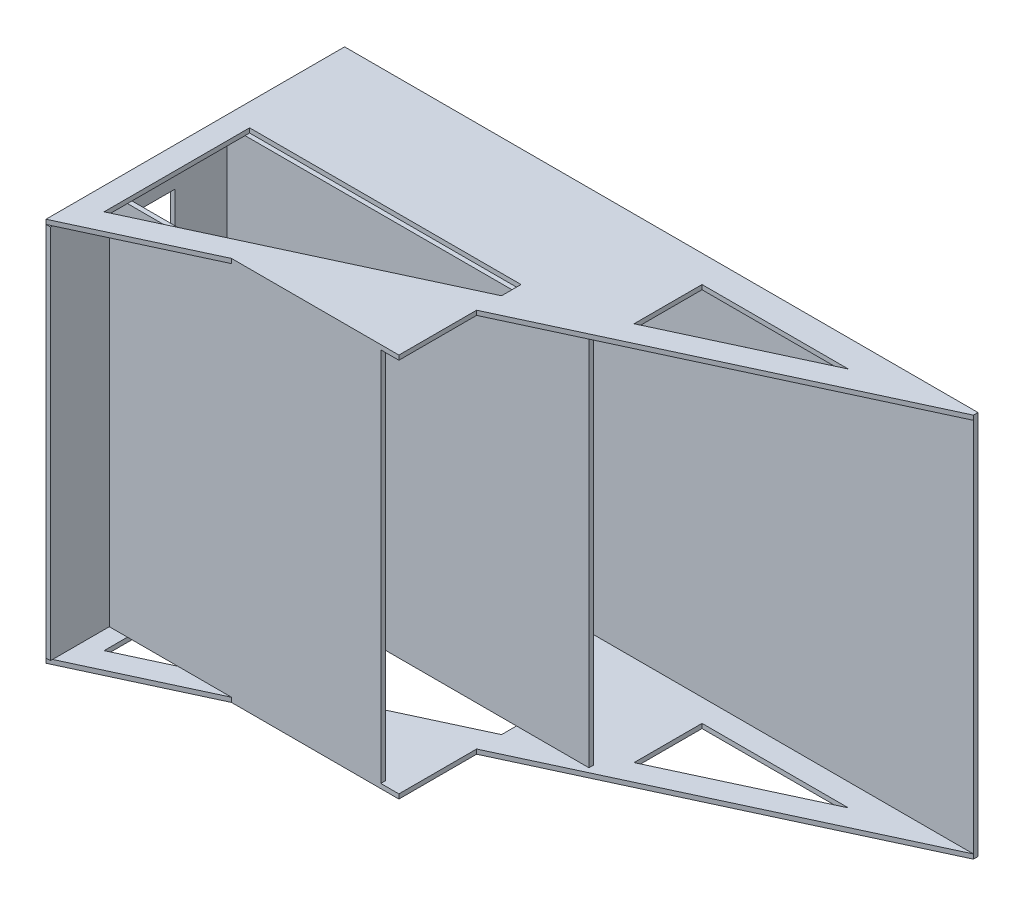
from build123d import *

# Parameters (mm, degrees)
SKETCH1_W             = 215.9
SKETCH1_H             = 355.6
BOSS_EXTRUDE1_DEPTH   = 2.54
BOSS_EXTRUDE2_DEPTH   = 2.54
CUT_EXTRUDE4_DEPTH    = 2.54
BOSS_EXTRUDE3_DEPTH   = 2.54
CUT_EXTRUDE5_DEPTH    = 2.54
SKETCH7_W             = 210.82
SKETCH7_H             = 165.1
SKETCH7_W_2           = 177.8
SKETCH7_H_2           = 31.75
BOSS_EXTRUDE4_DEPTH   = 2.54
SKETCH8_W             = 210.82
SKETCH8_H             = 2.54
BOSS_EXTRUDE6_DEPTH   = 203.2
SKETCH9_W             = 210.82
SKETCH9_H             = 2.54
BOSS_EXTRUDE7_DEPTH   = 152.4
BOSS_EXTRUDE8_START   = -2.54
BOSS_EXTRUDE8_DEPTH   = 2.54
BOSS_EXTRUDE9_START   = -2.54
BOSS_EXTRUDE9_DEPTH   = 2.54
BODY_MOVE_COPY2_ANGLE = 120


with BuildPart() as part:
    # Sketch1 → Boss-Extrude1 (new body)
    with BuildSketch(Plane(origin=(0, 0, 0), x_dir=(1, 0, 0), z_dir=(0, 1, 0))):
        with Locations((107.95, 177.8)):
            Rectangle(SKETCH1_W, SKETCH1_H)
    extrude(amount=BOSS_EXTRUDE1_DEPTH)

    # Sketch2 → Boss-Extrude2 (add)
    with BuildSketch(Plane(origin=(215.9, 0, 0), x_dir=(0, 0, -1), z_dir=(1, 0, 0))):
        Polygon((355.6, 2.54), (355.6, 167.64), (0, 2.54), align=None)
    extrude(amount=-BOSS_EXTRUDE2_DEPTH)

    # Sketch3 → Cut-Extrude4 (cut)
    with BuildSketch(Plane(origin=(215.9, 0, 0), x_dir=(0, 0, -1), z_dir=(1, 0, 0))):
        Polygon((139.7, 15.24), (57.51214351, 15.24), (139.7, 53.398647656), align=None)
        Polygon((190.5, 66.04), (190.5, 76.984361942), (342.9, 147.741504799), (342.9, 66.04), align=None)
    extrude(amount=-CUT_EXTRUDE4_DEPTH, mode=Mode.SUBTRACT)

    # Sketch5 → Boss-Extrude3 (add)
    with BuildSketch(Plane.ZY):
        Polygon((0, 2.54), (-355.6, 167.64), (-355.6, 2.54), align=None)
    extrude(amount=-BOSS_EXTRUDE3_DEPTH)

    # Sketch6 → Cut-Extrude5 (cut)
    with BuildSketch(Plane.ZY):
        Polygon((-139.7, 15.24), (-57.51214351, 15.24), (-139.7, 53.398647656), align=None)
        Polygon((-342.9, 66.04), (-190.5, 66.04), (-190.5, 76.984361942), (-342.9, 147.741504799), align=None)
    extrude(amount=-CUT_EXTRUDE5_DEPTH, mode=Mode.SUBTRACT)

    # Sketch7 → Boss-Extrude4 (add)
    with BuildSketch(Plane(origin=(0, 0, -355.6), x_dir=(-1, 0, 0), z_dir=(0, 0, -1))):
        with Locations((-107.95, 85.09)):
            Rectangle(SKETCH7_W, SKETCH7_H)
        with Locations((-107.95, 31.115)):
            Rectangle(SKETCH7_W_2, SKETCH7_H_2, mode=Mode.SUBTRACT)
        with Locations((-107.95, 113.665)):
            Rectangle(SKETCH7_W_2, SKETCH7_H_2, mode=Mode.SUBTRACT)
    extrude(amount=-BOSS_EXTRUDE4_DEPTH)

    # Sketch9 → Boss-Extrude7 (add)
    with BuildSketch(Plane.XY.offset(-353.06)):
        with Locations((107.95, 133.35)):
            Rectangle(SKETCH9_W, SKETCH9_H)
    extrude(amount=BOSS_EXTRUDE7_DEPTH)

    # Sketch10 → Boss-Extrude8 (add)
    with BuildSketch(Plane(origin=(215.9, 0, 0), x_dir=(0, 0, -1), z_dir=(1, 0, 0)).offset(BOSS_EXTRUDE8_START)):
        Polygon((284.48, 134.62), (190.5, 134.62), (190.5, 90.986428571), align=None)
    extrude(amount=BOSS_EXTRUDE8_DEPTH)

    # Sketch11 → Boss-Extrude9 (add)
    with BuildSketch(Plane.ZY.offset(BOSS_EXTRUDE9_START)):
        Polygon((-190.5, 134.62), (-284.48, 134.62), (-190.5, 90.986428571), align=None)
    extrude(amount=BOSS_EXTRUDE9_DEPTH)


with BuildPart() as body_2:
    # Sketch8 → Boss-Extrude6 (new body)
    with BuildSketch(Plane.XY.offset(-353.06)):
        with Locations((107.95, 67.31)):
            Rectangle(SKETCH8_W, SKETCH8_H)
    extrude(amount=BOSS_EXTRUDE6_DEPTH)


with BuildPart() as part_1:
    # Body-Move/Copy1: moved
    add(part.part.moved(Location((-107.95, 0, 0))))


with BuildPart() as body_2_1:
    # Body-Move/Copy1: moved
    add(body_2.part.moved(Location((-107.95, 0, 0))))


with BuildPart() as body_2_2:
    # Body-Move/Copy2: moved
    add(body_2_1.part.moved(Location((0, 0, 0))).rotate(Axis((46.355, 121.92, -168.275), (0.5773502691896252, 0.5773502691896252, 0.5773502691896272)), BODY_MOVE_COPY2_ANGLE))


with BuildPart() as part_2:
    # Body-Move/Copy2: moved
    add(part_1.part.moved(Location((0, 0, 0))).rotate(Axis((46.355, 121.92, -168.275), (0.5773502691896252, 0.5773502691896252, 0.5773502691896272)), BODY_MOVE_COPY2_ANGLE))


with BuildPart() as part_3:
    # Body-Move/Copy3: moved
    add(part_2.part.moved(Location((0, -75.692, 0))))


with BuildPart() as body_2_3:
    # Body-Move/Copy3: moved
    add(body_2_2.part.moved(Location((0, -75.692, 0))))


solid = Compound([part_3.part, body_2_3.part])
